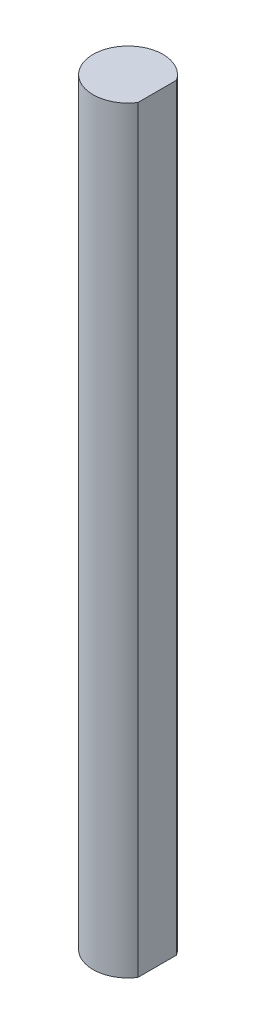
from build123d import *

# Parameters (mm, degrees)
BOSS_EXTRUDE1_DEPTH = 65


with BuildPart() as part:
    # Sketch1 → Boss-Extrude1 (new body)
    with BuildSketch(Plane(origin=(0, 0, 0), x_dir=(1, 0, 0), z_dir=(0, 1, 0))):
        with BuildLine():
            ThreePointArc((2.5, 1.658312395), (-0.866025404, 2.872281323), (-3, 0))
            Line((-3, 0), (2.5, 0))
            Line((2.5, 0), (2.5, 1.658312395))
        make_face()
        with BuildLine():
            Line((2.5, 0), (-3, 0))
            ThreePointArc((-3, 0), (-0.866025404, -2.872281323), (2.5, -1.658312395))
            Line((2.5, -1.658312395), (2.5, 0))
        make_face()
    extrude(amount=BOSS_EXTRUDE1_DEPTH)


solid = part.part
